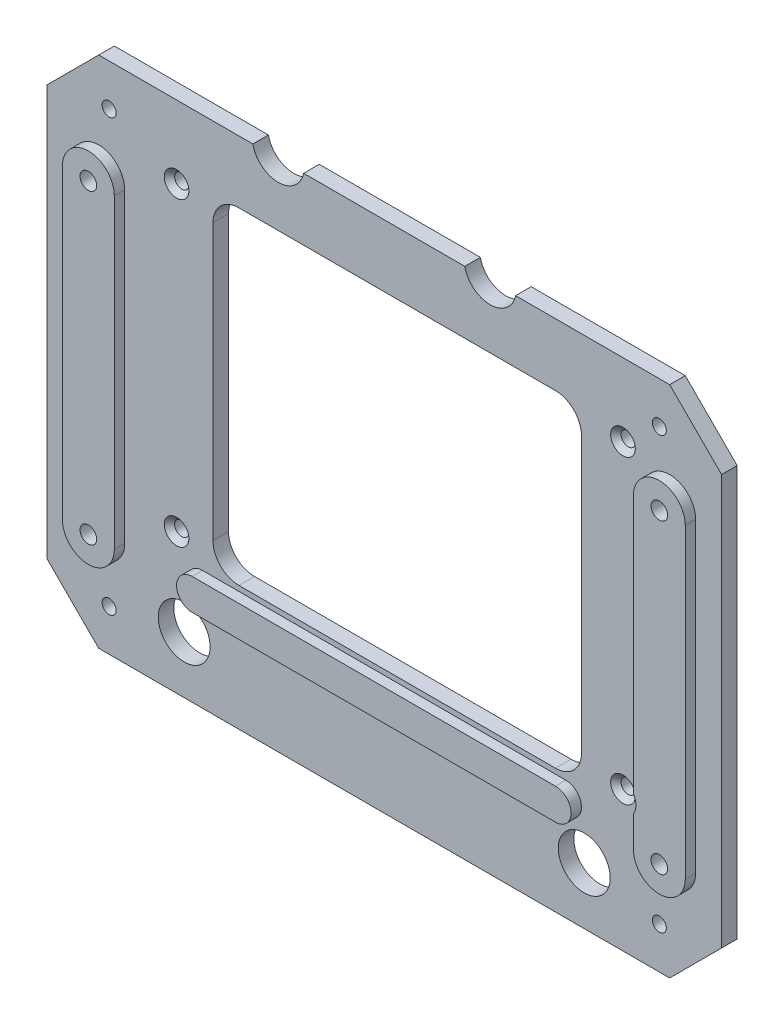
from build123d import *

# Parameters (mm, degrees)
SKETCH1_R          = 1.375
SKETCH1_R_2        = 5
EXTRUDE1_DEPTH     = 3
SKETCH2_R          = 1.6
CUT_EXTRUDE1_DEPTH = 3
SKETCH3_R          = 1.6
EXTRUDE2_DEPTH     = 2
EXTRUDE3_DEPTH     = 2
SKETCH5_R          = 1.35
CUT_EXTRUDE2_DEPTH = 5
CHAMFER1_SIZE      = 1


with BuildPart() as part:
    # Sketch1 → Extrude1 (new body)
    with BuildSketch(Plane.XY):
        with BuildLine():
            Line((9, 72), (-20.691500947, 72))
            ThreePointArc((-20.691500947, 72), (-25.583940659, 68.031520074), (-30.476380371, 72))
            Line((-30.476380371, 72), (-61.523619629, 72))
            ThreePointArc((-61.523619629, 72), (-66.416059341, 68.031520074), (-71.308499053, 72))
            Line((-71.308499053, 72), (-101, 72))
            Line((-101, 72), (-111, 62))
            Line((-111, 62), (-111, -17))
            Line((-111, -17), (-101, -27))
            Line((-101, -27), (9, -27))
            Line((9, -27), (19, -17))
            Line((19, -17), (19, 62))
            Line((19, 62), (9, 72))
        make_face()
        with Locations((-86, 0)):
            Circle(SKETCH1_R, mode=Mode.SUBTRACT)
        with Locations((-86, 58)):
            Circle(SKETCH1_R, mode=Mode.SUBTRACT)
        Circle(SKETCH1_R, mode=Mode.SUBTRACT)
        with Locations((0, 58)):
            Circle(SKETCH1_R, mode=Mode.SUBTRACT)
        with Locations((-7.462680425, -16.037319575)):
            Circle(SKETCH1_R_2, mode=Mode.SUBTRACT)
        with Locations((-84.537319575, -16.037319575)):
            Circle(SKETCH1_R_2, mode=Mode.SUBTRACT)
    extrude(amount=EXTRUDE1_DEPTH)

    # Sketch2 → Cut-Extrude1 (cut)
    with BuildSketch(Plane(origin=(0, 0, 0), x_dir=(-1, 0, 0), z_dir=(0, 0, -1))):
        with Locations((-9, 52)):
            Circle(SKETCH2_R)
        with Locations((-9, -7)):
            Circle(SKETCH2_R)
        with Locations((101, 52)):
            Circle(SKETCH2_R)
        with Locations((101, -7)):
            Circle(SKETCH2_R)
        with BuildLine():
            Line((13, 60), (74, 60))
            ThreePointArc((74, 60), (77.535533906, 58.535533906), (79, 55))
            Line((79, 55), (79, 2))
            ThreePointArc((79, 2), (77.535533906, -1.535533906), (74, -3))
            Line((74, -3), (13, -3))
            ThreePointArc((13, -3), (9.464466094, -1.535533906), (8, 2))
            Line((8, 2), (8, 55))
            ThreePointArc((8, 55), (9.464466094, 58.535533906), (13, 60))
        make_face()
    extrude(amount=-CUT_EXTRUDE1_DEPTH, mode=Mode.SUBTRACT)

    # Sketch3 → Extrude2 (add)
    # profile 1 of 2: a face of its own
    with BuildSketch(Plane.XY.offset(3)):
        with BuildLine():
            Line((4, -1.068897687), (4, -7))
            ThreePointArc((4, -7), (9, -12), (14, -7))
            Line((14, -7), (14, 52))
            ThreePointArc((14, 52), (9, 57), (4, 52))
            Line((4, 52), (4, 2.241917312))
            ThreePointArc((4, 2.241917312), (4.498075539, 0.586509812), (4, -1.068897687))
        make_face()
        with Locations(Location((9, -7, 0), (0, 0, 180))):
            Circle(SKETCH3_R, mode=Mode.SUBTRACT)
        with Locations(Location((9, 52, 0), (0, 0, 180))):
            Circle(SKETCH3_R, mode=Mode.SUBTRACT)
    # profile 2 of 2: a face of its own
    with BuildSketch(Plane.XY.offset(3)):
        with BuildLine():
            Line((-96, 52), (-96, -7))
            ThreePointArc((-96, -7), (-101, -12), (-106, -7))
            Line((-106, -7), (-106, 52))
            ThreePointArc((-106, 52), (-101, 57), (-96, 52))
        make_face()
        with Locations(Location((-101, -7, 0), (0, 0, 180))):
            Circle(SKETCH3_R, mode=Mode.SUBTRACT)
        with Locations(Location((-101, 52, 0), (0, 0, 180))):
            Circle(SKETCH3_R, mode=Mode.SUBTRACT)
    extrude(amount=EXTRUDE2_DEPTH)

    # Sketch4 → Extrude3 (add)
    with BuildSketch(Plane.XY.offset(3)):
        with BuildLine():
            Line((-11, -10), (-81, -10))
            ThreePointArc((-81, -10), (-84, -7), (-81, -4))
            Line((-81, -4), (-11, -4))
            ThreePointArc((-11, -4), (-8, -7), (-11, -10))
        make_face()
    extrude(amount=EXTRUDE3_DEPTH)

    # Sketch5 → Cut-Extrude2 (cut)
    with BuildSketch(Plane(origin=(0, 0, 0), x_dir=(-1, 0, 0), z_dir=(0, 0, -1))):
        with Locations((-7, 64)):
            Circle(SKETCH5_R)
        with Locations((99, 64)):
            Circle(SKETCH5_R)
        with Locations((99, -19)):
            Circle(SKETCH5_R)
        with Locations((-7, -19)):
            Circle(SKETCH5_R)
    extrude(amount=-CUT_EXTRUDE2_DEPTH, mode=Mode.SUBTRACT)

    # Chamfer1
    chamfer1_edges = [part.edges().sort_by_distance(p)[0] for p in [
        (-87.375, 0, 3),
        (-87.375, 58, 3),
        (-1.375, 0, 3),
        (-1.375, 58, 3),
    ]]
    chamfer(chamfer1_edges, length=CHAMFER1_SIZE)


solid = part.part
